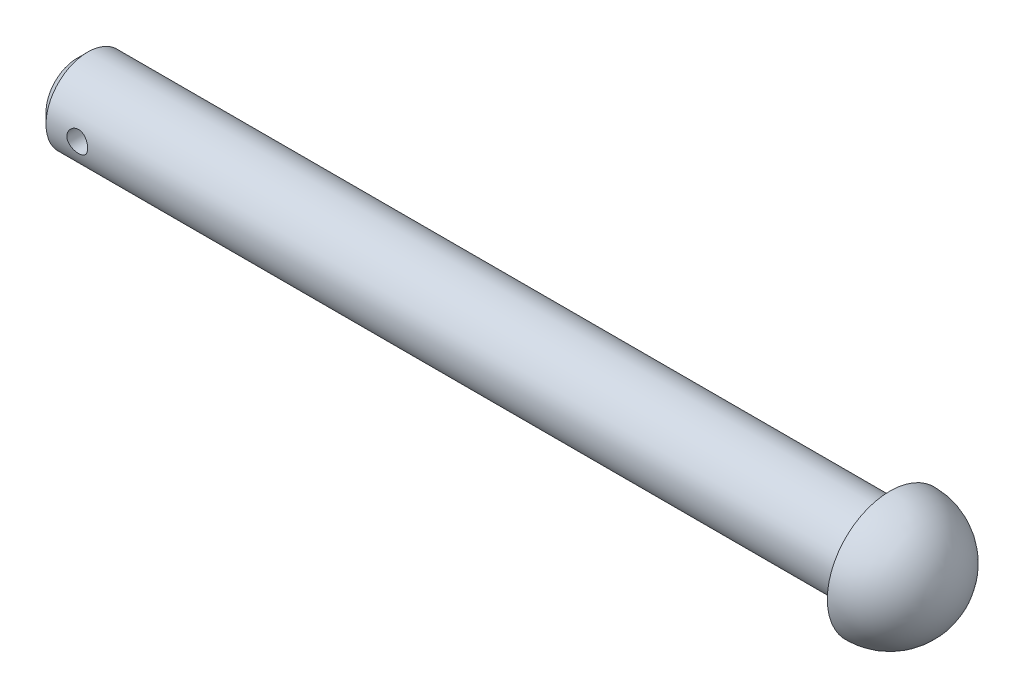
from build123d import *

# Parameters (mm, degrees)
CUT_EXTRUDE1_DEPTH      = 43.213741838
CUT_EXTRUDE1_DEPTH_BACK = 43.213741838
SKETCH3_R               = 0.5
CHAMFER1_SIZE           = 0.5


with BuildPart() as part:
    # Sketch2 → Revolve1 (revolve)
    with BuildSketch(Plane.XY):
        with BuildLine():
            Line((39, 2), (39, 3))
            ThreePointArc((39, 3), (41.121320344, 2.121320344), (42, 0))
            Line((42, 0), (39, 0))
            Line((39, 0), (0, 0))
            Line((0, 0), (0, 2))
            Line((0, 2), (39, 2))
        make_face()
    revolve(axis=Axis((0, 0, 0), (1, 0, 0)))

    # Sketch3 → Cut-Extrude1 (cut, two sides: drawn at the far end of the back side and taken through both)
    with BuildSketch(Plane.XY.offset(-CUT_EXTRUDE1_DEPTH_BACK)):
        with Locations((2, 0)):
            Circle(SKETCH3_R)
    extrude(amount=CUT_EXTRUDE1_DEPTH + CUT_EXTRUDE1_DEPTH_BACK, mode=Mode.SUBTRACT)

    # Chamfer1
    chamfer1_edges = [part.edges().sort_by_distance(p)[0] for p in [
        (0, -2, 0),
    ]]
    chamfer(chamfer1_edges, length=CHAMFER1_SIZE)


solid = part.part
